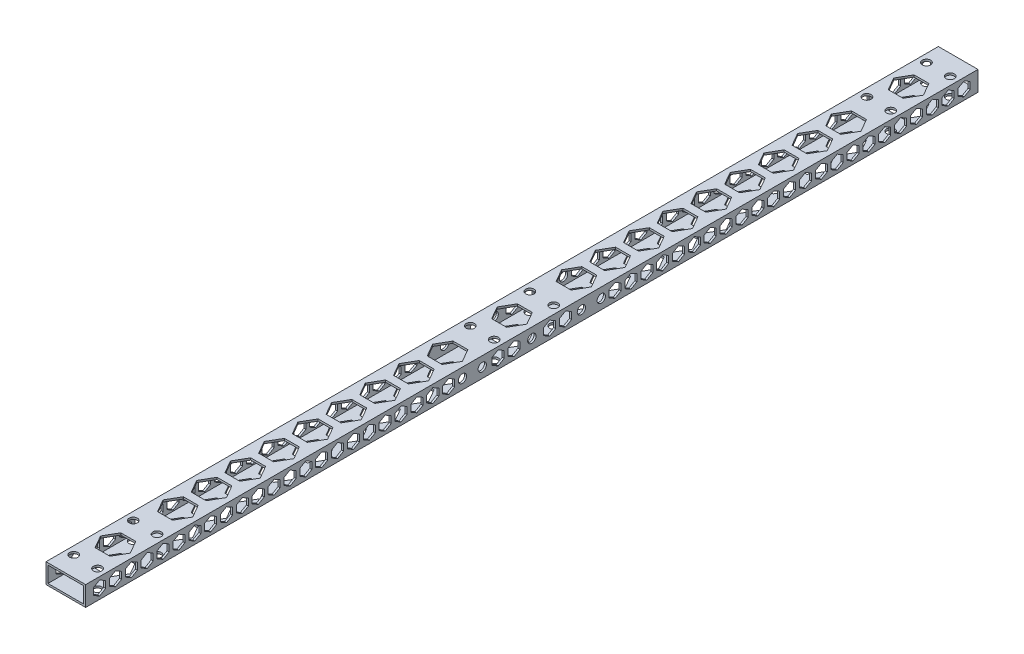
from build123d import *

# Parameters (mm, degrees)
SKETCH_1_W          = 20
SKETCH_1_H          = 10
SKETCH_1_W_2        = 18
SKETCH_1_H_2        = 8
EXTRUDE_1_DEPTH     = 450
SKETCH_2_R          = 2.1
CUT_EXTRUDE_1_DEPTH = 451.555213043
SKETCH_3_R          = 2.1
CUT_EXTRUDE_2_DEPTH = 451.555213043


with BuildPart() as part:
    # 草图1 → 拉伸-薄壁1 (new body)
    with BuildSketch(Plane.XY):
        with Locations((10, -5)):
            Rectangle(SKETCH_1_W, SKETCH_1_H)
        with Locations((10, -5)):
            Rectangle(SKETCH_1_W_2, SKETCH_1_H_2, mode=Mode.SUBTRACT)
    extrude(amount=EXTRUDE_1_DEPTH)

    # 草图2 → 切除-拉伸1 (cut, through all)
    with BuildSketch(Plane(origin=(0, 0, 0), x_dir=(1, 0, 0), z_dir=(0, 1, 0))):
        with Locations(Location((4, -210, 0), (0, 0, 270))):
            Circle(SKETCH_2_R)
        with Locations(Location((16, -210, 0), (0, 0, 90))):
            Circle(SKETCH_2_R)
        with Locations(Location((16, -240, 0), (0, 0, 270))):
            Circle(SKETCH_2_R)
        with Locations(Location((4, -240, 0), (0, 0, 90))):
            Circle(SKETCH_2_R)
        with Locations(Location((4, -10, 0), (0, 0, 270))):
            Circle(SKETCH_2_R)
        with Locations(Location((16, -10, 0), (0, 0, 90))):
            Circle(SKETCH_2_R)
        with Locations(Location((16, -40, 0), (0, 0, 270))):
            Circle(SKETCH_2_R)
        with Locations(Location((4, -40, 0), (0, 0, 90))):
            Circle(SKETCH_2_R)
        with Locations(Location((4, -410, 0), (0, 0, 270))):
            Circle(SKETCH_2_R)
        with Locations(Location((16, -410, 0), (0, 0, 90))):
            Circle(SKETCH_2_R)
        with Locations(Location((16, -440, 0), (0, 0, 270))):
            Circle(SKETCH_2_R)
        with Locations(Location((4, -440, 0), (0, 0, 90))):
            Circle(SKETCH_2_R)
        Polygon((13.75, -67), (6.25, -67), (2.5, -73.495190528), (6.25, -79.990381057), (13.75, -79.990381057), (17.5, -73.495190528), align=None)
        Polygon((13.75, -50), (6.25, -50), (2.5, -56.495190528), (6.25, -62.990381057), (13.75, -62.990381057), (17.5, -56.495190528), align=None)
        Polygon((13.75, -84), (6.25, -84), (2.5, -90.495190528), (6.25, -96.990381057), (13.75, -96.990381057), (17.5, -90.495190528), align=None)
        Polygon((13.75, -101), (6.25, -101), (2.5, -107.495190528), (6.25, -113.990381057), (13.75, -113.990381057), (17.5, -107.495190528), align=None)
        Polygon((13.75, -118), (6.25, -118), (2.5, -124.495190528), (6.25, -130.990381057), (13.75, -130.990381057), (17.5, -124.495190528), align=None)
        Polygon((13.75, -135), (6.25, -135), (2.5, -141.495190528), (6.25, -147.990381057), (13.75, -147.990381057), (17.5, -141.495190528), align=None)
        Polygon((13.75, -152), (6.25, -152), (2.5, -158.495190528), (6.25, -164.990381057), (13.75, -164.990381057), (17.5, -158.495190528), align=None)
        Polygon((13.75, -169), (6.25, -169), (2.5, -175.495190528), (6.25, -181.990381057), (13.75, -181.990381057), (17.5, -175.495190528), align=None)
        Polygon((13.75, -186), (6.25, -186), (2.5, -192.495190528), (6.25, -198.990381057), (13.75, -198.990381057), (17.5, -192.495190528), align=None)
        Polygon((6.25, -251.009618943), (13.75, -251.009618943), (17.5, -257.504809472), (13.75, -264), (6.25, -264), (2.5, -257.504809472), align=None)
        Polygon((6.25, -281), (2.5, -274.504809472), (6.25, -268.009618943), (13.75, -268.009618943), (17.5, -274.504809472), (13.75, -281), align=None)
        Polygon((6.25, -298), (2.5, -291.504809472), (6.25, -285.009618943), (13.75, -285.009618943), (17.5, -291.504809472), (13.75, -298), align=None)
        Polygon((6.25, -315), (2.5, -308.504809472), (6.25, -302.009618943), (13.75, -302.009618943), (17.5, -308.504809472), (13.75, -315), align=None)
        Polygon((6.25, -332), (2.5, -325.504809472), (6.25, -319.009618943), (13.75, -319.009618943), (17.5, -325.504809472), (13.75, -332), align=None)
        Polygon((6.25, -349), (2.5, -342.504809472), (6.25, -336.009618943), (13.75, -336.009618943), (17.5, -342.504809472), (13.75, -349), align=None)
        Polygon((6.25, -366), (2.5, -359.504809472), (6.25, -353.009618943), (13.75, -353.009618943), (17.5, -359.504809472), (13.75, -366), align=None)
        Polygon((6.25, -383), (2.5, -376.504809472), (6.25, -370.009618943), (13.75, -370.009618943), (17.5, -376.504809472), (13.75, -383), align=None)
        Polygon((17.5, -393.504809472), (13.75, -400), (6.25, -400), (2.5, -393.504809472), (6.25, -387.009618943), (13.75, -387.009618943), align=None)
        Polygon((2.5, -425), (6.25, -431.495190528), (13.75, -431.495190528), (17.5, -425), (13.75, -418.504809472), (6.25, -418.504809472), align=None)
        Polygon((6.25, -31.495190528), (2.5, -25), (6.25, -18.504809472), (13.75, -18.504809472), (17.5, -25), (13.75, -31.495190528), align=None)
        Polygon((2.5, -225), (6.25, -231.495190528), (13.75, -231.495190528), (17.5, -225), (13.75, -218.504809472), (6.25, -218.504809472), align=None)
    extrude(amount=-CUT_EXTRUDE_1_DEPTH, mode=Mode.SUBTRACT)

    # 草图3 → 切除-拉伸2 (cut, through all)
    with BuildSketch(Plane(origin=(20, 0, 0), x_dir=(0, 0, -1), z_dir=(1, 0, 0))):
        with Locations((-250, -5)):
            Circle(SKETCH_3_R)
        with Locations((-260, -5)):
            Circle(SKETCH_3_R)
        with Locations(Location((-190, -5, 0), (0, 0, 180))):
            Circle(SKETCH_3_R)
        with Locations(Location((-200, -5, 0), (0, 0, 180))):
            Circle(SKETCH_3_R)
        with Locations((-225, -5)):
            Circle(SKETCH_3_R)
        Polygon((-434.968911087, -1.5), (-438, -3.25), (-438, -6.75), (-434.968911087, -8.5), (-431.937822174, -6.75), (-431.937822174, -3.25), align=None)
        Polygon((-442.968911087, -1.5), (-446, -3.25), (-446, -6.75), (-442.968911087, -8.5), (-439.937822174, -6.75), (-439.937822174, -3.25), align=None)
        Polygon((-426.968911087, -1.5), (-430, -3.25), (-430, -6.75), (-426.968911087, -8.5), (-423.937822174, -6.75), (-423.937822174, -3.25), align=None)
        Polygon((-418.968911087, -1.5), (-422, -3.25), (-422, -6.75), (-418.968911087, -8.5), (-415.937822174, -6.75), (-415.937822174, -3.25), align=None)
        Polygon((-410.968911087, -1.5), (-414, -3.25), (-414, -6.75), (-410.968911087, -8.5), (-407.937822174, -6.75), (-407.937822174, -3.25), align=None)
        Polygon((-402.968911087, -1.5), (-406, -3.25), (-406, -6.75), (-402.968911087, -8.5), (-399.937822174, -6.75), (-399.937822174, -3.25), align=None)
        Polygon((-394.968911087, -1.5), (-398, -3.25), (-398, -6.75), (-394.968911087, -8.5), (-391.937822174, -6.75), (-391.937822174, -3.25), align=None)
        Polygon((-386.968911087, -1.5), (-390, -3.25), (-390, -6.75), (-386.968911087, -8.5), (-383.937822174, -6.75), (-383.937822174, -3.25), align=None)
        Polygon((-378.968911087, -1.5), (-382, -3.25), (-382, -6.75), (-378.968911087, -8.5), (-375.937822174, -6.75), (-375.937822174, -3.25), align=None)
        Polygon((-370.968911087, -1.5), (-374, -3.25), (-374, -6.75), (-370.968911087, -8.5), (-367.937822174, -6.75), (-367.937822174, -3.25), align=None)
        Polygon((-362.968911087, -1.5), (-366, -3.25), (-366, -6.75), (-362.968911087, -8.5), (-359.937822174, -6.75), (-359.937822174, -3.25), align=None)
        Polygon((-354.968911087, -1.5), (-358, -3.25), (-358, -6.75), (-354.968911087, -8.5), (-351.937822174, -6.75), (-351.937822174, -3.25), align=None)
        Polygon((-346.968911087, -1.5), (-350, -3.25), (-350, -6.75), (-346.968911087, -8.5), (-343.937822174, -6.75), (-343.937822174, -3.25), align=None)
        Polygon((-338.968911087, -1.5), (-342, -3.25), (-342, -6.75), (-338.968911087, -8.5), (-335.937822174, -6.75), (-335.937822174, -3.25), align=None)
        Polygon((-330.968911087, -1.5), (-334, -3.25), (-334, -6.75), (-330.968911087, -8.5), (-327.937822174, -6.75), (-327.937822174, -3.25), align=None)
        Polygon((-322.968911087, -1.5), (-326, -3.25), (-326, -6.75), (-322.968911087, -8.5), (-319.937822174, -6.75), (-319.937822174, -3.25), align=None)
        Polygon((-314.968911087, -1.5), (-318, -3.25), (-318, -6.75), (-314.968911087, -8.5), (-311.937822174, -6.75), (-311.937822174, -3.25), align=None)
        Polygon((-306.968911087, -1.5), (-310, -3.25), (-310, -6.75), (-306.968911087, -8.5), (-303.937822174, -6.75), (-303.937822174, -3.25), align=None)
        Polygon((-298.968911087, -1.5), (-302, -3.25), (-302, -6.75), (-298.968911087, -8.5), (-295.937822174, -6.75), (-295.937822174, -3.25), align=None)
        Polygon((-290.968911087, -1.5), (-294, -3.25), (-294, -6.75), (-290.968911087, -8.5), (-287.937822174, -6.75), (-287.937822174, -3.25), align=None)
        Polygon((-282.968911087, -1.5), (-286, -3.25), (-286, -6.75), (-282.968911087, -8.5), (-279.937822174, -6.75), (-279.937822174, -3.25), align=None)
        Polygon((-274.968911087, -1.5), (-278, -3.25), (-278, -6.75), (-274.968911087, -8.5), (-271.937822174, -6.75), (-271.937822174, -3.25), align=None)
        Polygon((-266.968911087, -1.5), (-270, -3.25), (-270, -6.75), (-266.968911087, -8.5), (-263.937822174, -6.75), (-263.937822174, -3.25), align=None)
        Polygon((-180, -6.75), (-183.031088913, -8.5), (-186.062177826, -6.75), (-186.062177826, -3.25), (-183.031088913, -1.5), (-180, -3.25), align=None)
        Polygon((-172, -6.75), (-175.031088913, -8.5), (-178.062177826, -6.75), (-178.062177826, -3.25), (-175.031088913, -1.5), (-172, -3.25), align=None)
        Polygon((-164, -6.75), (-167.031088913, -8.5), (-170.062177826, -6.75), (-170.062177826, -3.25), (-167.031088913, -1.5), (-164, -3.25), align=None)
        Polygon((-156, -6.75), (-159.031088913, -8.5), (-162.062177826, -6.75), (-162.062177826, -3.25), (-159.031088913, -1.5), (-156, -3.25), align=None)
        Polygon((-148, -6.75), (-151.031088913, -8.5), (-154.062177826, -6.75), (-154.062177826, -3.25), (-151.031088913, -1.5), (-148, -3.25), align=None)
        Polygon((-140, -6.75), (-143.031088913, -8.5), (-146.062177826, -6.75), (-146.062177826, -3.25), (-143.031088913, -1.5), (-140, -3.25), align=None)
        Polygon((-132, -6.75), (-135.031088913, -8.5), (-138.062177826, -6.75), (-138.062177826, -3.25), (-135.031088913, -1.5), (-132, -3.25), align=None)
        Polygon((-124, -6.75), (-127.031088913, -8.5), (-130.062177826, -6.75), (-130.062177826, -3.25), (-127.031088913, -1.5), (-124, -3.25), align=None)
        Polygon((-116, -6.75), (-119.031088913, -8.5), (-122.062177826, -6.75), (-122.062177826, -3.25), (-119.031088913, -1.5), (-116, -3.25), align=None)
        Polygon((-108, -6.75), (-111.031088913, -8.5), (-114.062177826, -6.75), (-114.062177826, -3.25), (-111.031088913, -1.5), (-108, -3.25), align=None)
        Polygon((-100, -6.75), (-103.031088913, -8.5), (-106.062177826, -6.75), (-106.062177826, -3.25), (-103.031088913, -1.5), (-100, -3.25), align=None)
        Polygon((-92, -6.75), (-95.031088913, -8.5), (-98.062177826, -6.75), (-98.062177826, -3.25), (-95.031088913, -1.5), (-92, -3.25), align=None)
        Polygon((-84, -6.75), (-87.031088913, -8.5), (-90.062177826, -6.75), (-90.062177826, -3.25), (-87.031088913, -1.5), (-84, -3.25), align=None)
        Polygon((-76, -6.75), (-79.031088913, -8.5), (-82.062177826, -6.75), (-82.062177826, -3.25), (-79.031088913, -1.5), (-76, -3.25), align=None)
        Polygon((-68, -6.75), (-71.031088913, -8.5), (-74.062177826, -6.75), (-74.062177826, -3.25), (-71.031088913, -1.5), (-68, -3.25), align=None)
        Polygon((-60, -6.75), (-63.031088913, -8.5), (-66.062177826, -6.75), (-66.062177826, -3.25), (-63.031088913, -1.5), (-60, -3.25), align=None)
        Polygon((-52, -6.75), (-55.031088913, -8.5), (-58.062177826, -6.75), (-58.062177826, -3.25), (-55.031088913, -1.5), (-52, -3.25), align=None)
        Polygon((-44, -6.75), (-47.031088913, -8.5), (-50.062177826, -6.75), (-50.062177826, -3.25), (-47.031088913, -1.5), (-44, -3.25), align=None)
        Polygon((-36, -6.75), (-39.031088913, -8.5), (-42.062177826, -6.75), (-42.062177826, -3.25), (-39.031088913, -1.5), (-36, -3.25), align=None)
        Polygon((-28, -6.75), (-31.031088913, -8.5), (-34.062177826, -6.75), (-34.062177826, -3.25), (-31.031088913, -1.5), (-28, -3.25), align=None)
        Polygon((-20, -6.75), (-23.031088913, -8.5), (-26.062177826, -6.75), (-26.062177826, -3.25), (-23.031088913, -1.5), (-20, -3.25), align=None)
        Polygon((-12, -6.75), (-15.031088913, -8.5), (-18.062177826, -6.75), (-18.062177826, -3.25), (-15.031088913, -1.5), (-12, -3.25), align=None)
        Polygon((-10.062177826, -3.25), (-7.031088913, -1.5), (-4, -3.25), (-4, -6.75), (-7.031088913, -8.5), (-10.062177826, -6.75), align=None)
        Polygon((-234, -1.5), (-237.031088913, -3.25), (-237.031088913, -6.75), (-234, -8.5), (-230.968911087, -6.75), (-230.968911087, -3.25), align=None)
        Polygon((-242, -1.5), (-245.031088913, -3.25), (-245.031088913, -6.75), (-242, -8.5), (-238.968911087, -6.75), (-238.968911087, -3.25), align=None)
        Polygon((-219.031088913, -6.75), (-219.031088913, -3.25), (-216, -1.5), (-212.968911087, -3.25), (-212.968911087, -6.75), (-216, -8.5), align=None)
        Polygon((-211.031088913, -3.25), (-208, -1.5), (-204.968911087, -3.25), (-204.968911087, -6.75), (-208, -8.5), (-211.031088913, -6.75), align=None)
    extrude(amount=-CUT_EXTRUDE_2_DEPTH, mode=Mode.SUBTRACT)


solid = part.part
